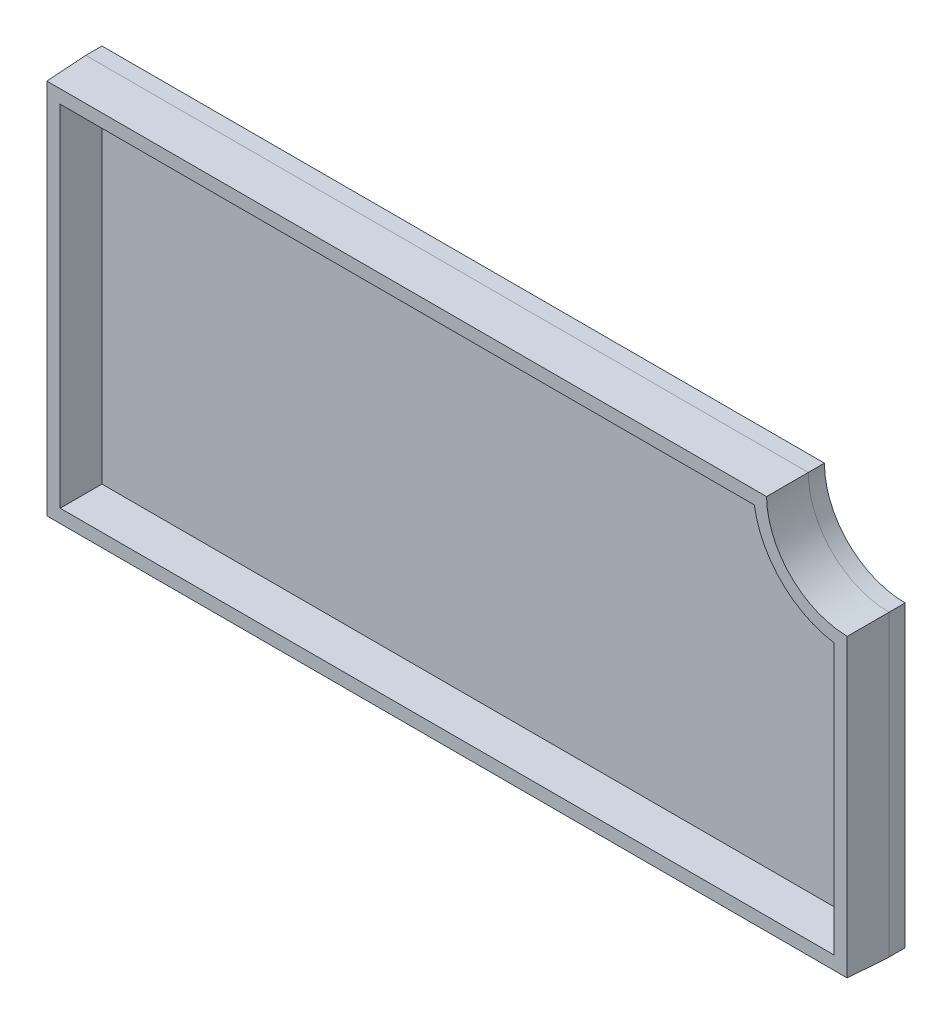
from build123d import *

# Parameters (mm, degrees)
BOSS_EXTRU_1_DEPTH = 2
BOSS_EXTRU_2_DEPTH = 5
BOSS_EXTRU_2_DRAFT = 2


with BuildPart() as part:
    # Esquisse1 → Boss.-Extru.1 (new body)
    with BuildSketch(Plane.XY):
        with BuildLine():
            Line((0, 0), (99.5, 0))
            Line((99.5, 0), (99.5, 37))
            ThreePointArc((99.5, 37), (92.428932188, 39.928932188), (89.5, 47))
            Line((89.5, 47), (0, 47))
            Line((0, 47), (0, 0))
        make_face()
    extrude(amount=BOSS_EXTRU_1_DEPTH)


with BuildPart() as boss_extru_2_tool:
    # Esquisse2 → Boss.-Extru.2 (with draft: the straight prism first)
    with BuildSketch(Plane.XY.offset(2)):
        with BuildLine():
            Line((0, 47), (0, 0))
            Line((0, 0), (99.5, 0))
            Line((99.5, 0), (99.5, 37))
            ThreePointArc((99.5, 37), (92.428932188, 39.928932188), (89.5, 47))
            Line((89.5, 47), (0, 47))
        make_face()
        with BuildLine():
            Line((2, 45), (2, 2))
            Line((2, 2), (97.5, 2))
            Line((97.5, 2), (97.5, 35.167840434))
            ThreePointArc((97.5, 35.167840434), (91.014718626, 38.514718626), (87.667840434, 45))
            Line((87.667840434, 45), (2, 45))
        make_face(mode=Mode.SUBTRACT)
    extrude(amount=BOSS_EXTRU_2_DEPTH)
    # Boss.-Extru.2: the draft: its side faces are tilted about the plane it starts from
    boss_extru_2_sides = [boss_extru_2_tool.faces().sort_by_distance(p)[0] for p in [
        (92.428932188, 39.928932188, 4.5),
        (44.75, 47, 4.5),
        (0, 23.5, 4.5),
        (49.75, 0, 4.5),
        (99.5, 18.5, 4.5),
        (44.833920217, 45, 4.5),
        (91.014718626, 38.514718626, 4.5),
        (97.5, 18.583920217, 4.5),
        (49.75, 2, 4.5),
        (2, 23.5, 4.5),
    ]]
    draft(boss_extru_2_sides, Plane.XY.offset(2), BOSS_EXTRU_2_DRAFT)


with BuildPart() as part_1:
    add(part.part)

    # Boss.-Extru.2: add boss_extru_2_tool
    add(boss_extru_2_tool.part)


solid = part_1.part
